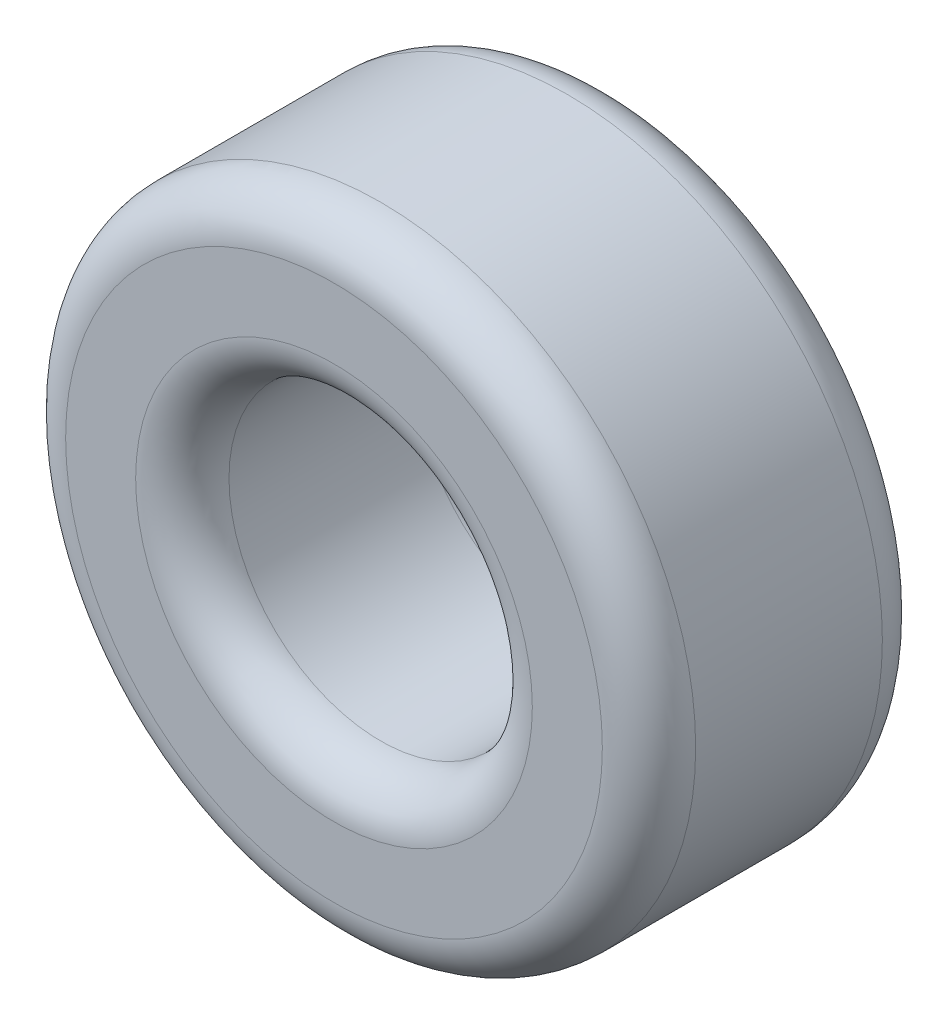
from build123d import *

# Parameters (mm, degrees)
SKETCH_1_R      = 27
SKETCH_1_R_2    = 13
EXTRUDE_1_DEPTH = 24
FILLET_1_R      = 4


with BuildPart() as part:
    # Эскиз1 → Вытянуть1 (new body)
    with BuildSketch(Plane.XY):
        Circle(SKETCH_1_R)
        Circle(SKETCH_1_R_2, mode=Mode.SUBTRACT)
    extrude(amount=EXTRUDE_1_DEPTH)

    # Скругление1
    fillet_1_edges = [part.edges().sort_by_distance(p)[0] for p in [
        (-27, 0, 0),
        (-27, 0, 24),
        (-13, 0, 0),
        (-13, 0, 24),
    ]]
    fillet(fillet_1_edges, radius=FILLET_1_R)


solid = part.part
